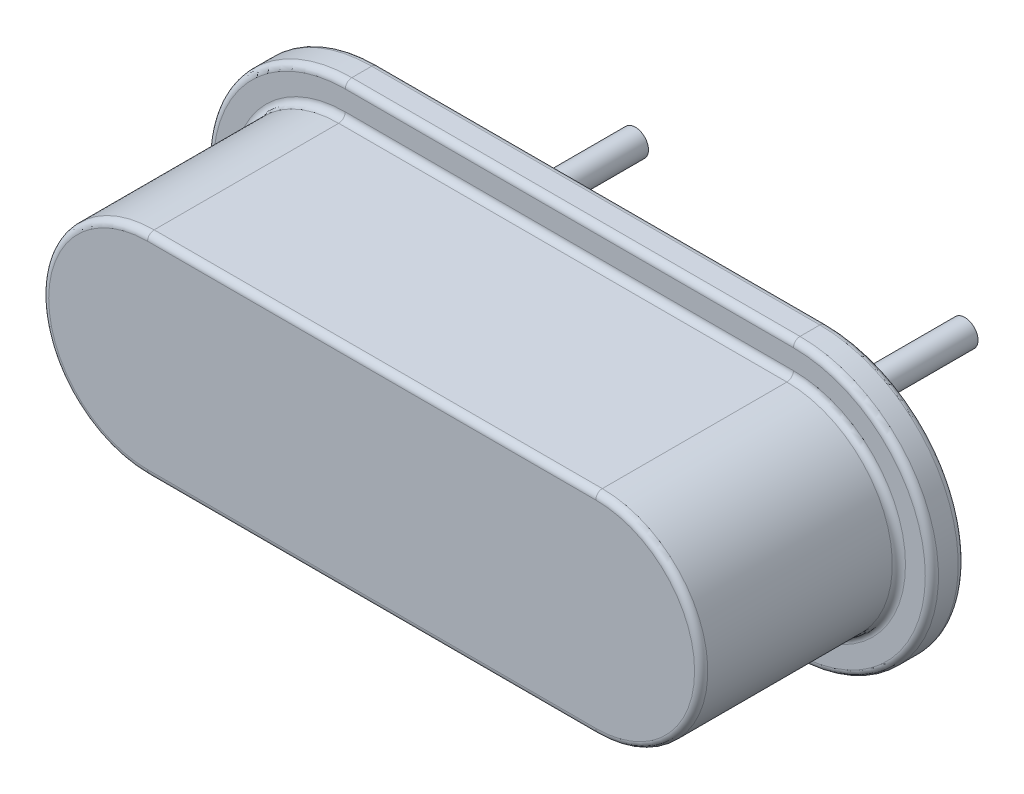
from build123d import *

# Parameters (mm, degrees)
EXTRUDE_1_DEPTH = 0.5
EXTRUDE_2_DEPTH = 3
SKETCH_3_R      = 0.2
EXTRUDE_3_DEPTH = 3
FILLET_1_R      = 0.1


with BuildPart() as part:
    # 草图1 → 凸台-拉伸1 (new body)
    with BuildSketch(Plane.XY):
        with BuildLine():
            Line((3.4, 2.1), (-3.4, 2.1))
            ThreePointArc((-3.4, 2.1), (-5.5, 0), (-3.4, -2.1))
            Line((-3.4, -2.1), (3.4, -2.1))
            ThreePointArc((3.4, -2.1), (5.5, 0), (3.4, 2.1))
        make_face()
    extrude(amount=EXTRUDE_1_DEPTH)

    # 草图2 → 凸台-拉伸2 (add)
    with BuildSketch(Plane.XY.offset(0.5)):
        with BuildLine():
            Line((-3.4, 1.6), (3.4, 1.6))
            ThreePointArc((3.4, 1.6), (5, 0), (3.4, -1.6))
            Line((3.4, -1.6), (-3.4, -1.6))
            ThreePointArc((-3.4, -1.6), (-5, 0), (-3.4, 1.6))
        make_face()
    extrude(amount=EXTRUDE_2_DEPTH)

    # 草图3 → 凸台-拉伸3 (add)
    with BuildSketch(Plane(origin=(0, 0, 0), x_dir=(-1, 0, 0), z_dir=(0, 0, -1))):
        with Locations(Location((-2.5, 0, 0), (0, 0, 180))):
            Circle(SKETCH_3_R)
        with Locations(Location((2.5, 0, 0), (0, 0, 180))):
            Circle(SKETCH_3_R)
    extrude(amount=EXTRUDE_3_DEPTH)

    # 圆角1
    fillet_1_edges = [part.edges().sort_by_distance(p)[0] for p in [
        (-5.5, 0, 0.5),
        (0, -2.1, 0.5),
        (5, 0, 0.5),
        (0, 1.6, 0.5),
        (-5, 0, 0.5),
        (0, -1.6, 0.5),
        (5, 0, 3.5),
        (0, 1.6, 3.5),
        (-5, 0, 3.5),
        (0, -1.6, 3.5),
        (5.5, 0, 0.5),
        (0, -2.1, 0),
        (-5.5, 0, 0),
        (0, 2.1, 0),
        (5.5, 0, 0),
        (0, 2.1, 0.5),
    ]]
    fillet(fillet_1_edges, radius=FILLET_1_R)


solid = part.part
